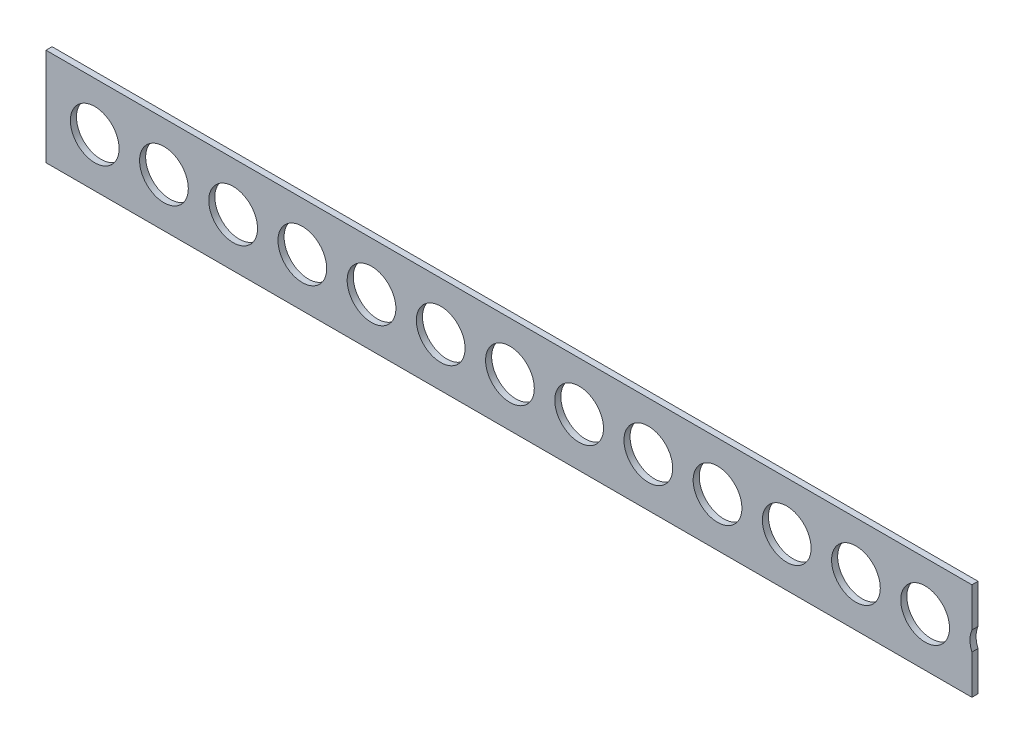
from build123d import *

# Parameters (mm, degrees)
SKETCH1_W           = 482.6
SKETCH1_H           = 50.8
BOSS_EXTRUDE1_DEPTH = 3.175
SKETCH2_R           = 12.7
CUT_EXTRUDE1_DEPTH  = 486.276705216
LPATTERN1_COUNT     = 15
LPATTERN1_PITCH     = 36.068


with BuildPart() as part:
    # Sketch1 → Boss-Extrude1 (new body)
    with BuildSketch(Plane.XY):
        with Locations((241.3, 25.4)):
            Rectangle(SKETCH1_W, SKETCH1_H)
    extrude(amount=BOSS_EXTRUDE1_DEPTH)

    # Sketch2 → Cut-Extrude1 (cut, through all)
    with BuildSketch(Plane.XY.offset(3.175)):
        with Locations((25.4, 25.4)):
            Circle(SKETCH2_R)
    cut_extrude1 = extrude(amount=-CUT_EXTRUDE1_DEPTH, mode=Mode.SUBTRACT)

    # LPattern1: Cut-Extrude1 ×15
    with Locations(*[(i * LPATTERN1_PITCH, 0, 0) for i in range(1, LPATTERN1_COUNT)]):
        add(cut_extrude1, mode=Mode.SUBTRACT)


solid = part.part
